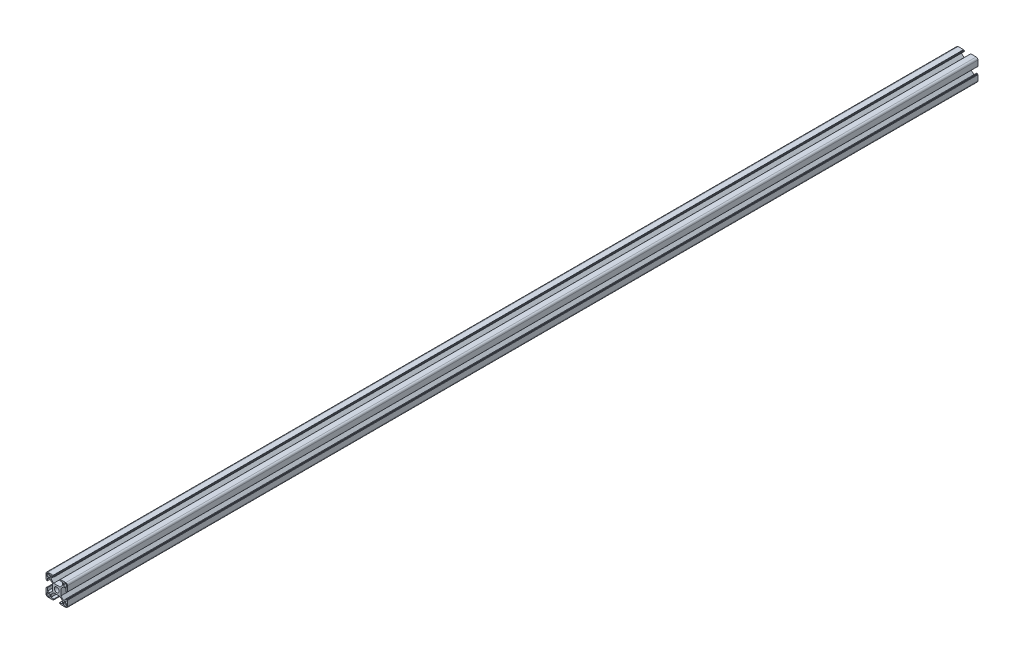
from build123d import *

# Parameters (mm, degrees)
SKETCH1_R      = 3.4
EXTRUDE1_DEPTH = 1268
EXTRUDE2_DEPTH = 1269.177432381


with BuildPart() as part:
    # Sketch1 → Extrude1 (new body)
    with BuildSketch(Plane.XY):
        with BuildLine():
            Line((-5.1, 14.2), (-5.1, 15))
            Line((-5.1, 15), (-12.5, 15))
            ThreePointArc((-12.5, 15), (-14.267766953, 14.267766953), (-15, 12.5))
            Line((-15, 12.5), (-15, 5.1))
            Line((-15, 5.1), (-14.2, 5.1))
            Line((-14.2, 5.1), (-14.2, 4.1))
            Line((-14.2, 4.1), (-13.2, 4.1))
            Line((-13.2, 4.1), (-13.2, 8.25))
            Line((-13.2, 8.25), (-9.522792206, 8.25))
            Line((-9.522792206, 8.25), (-5.7, 4.427207794))
            Line((-5.7, 4.427207794), (-5.7, -4.427207794))
            Line((-5.7, -4.427207794), (-9.522792206, -8.25))
            Line((-9.522792206, -8.25), (-13.2, -8.25))
            Line((-13.2, -8.25), (-13.2, -4.1))
            Line((-13.2, -4.1), (-14.2, -4.1))
            Line((-14.2, -4.1), (-14.2, -5.1))
            Line((-14.2, -5.1), (-15, -5.1))
            Line((-15, -5.1), (-15, -12.5))
            ThreePointArc((-15, -12.5), (-14.267766953, -14.267766953), (-12.5, -15))
            Line((-12.5, -15), (-5.1, -15))
            Line((-5.1, -15), (-5.1, -14.2))
            Line((-5.1, -14.2), (-4.1, -14.2))
            Line((-4.1, -14.2), (-4.1, -13.2))
            Line((-4.1, -13.2), (-8.25, -13.2))
            Line((-8.25, -13.2), (-8.25, -9.522792206))
            Line((-8.25, -9.522792206), (-4.427207794, -5.7))
            Line((-4.427207794, -5.7), (4.427207794, -5.7))
            Line((4.427207794, -5.7), (8.25, -9.522792206))
            Line((8.25, -9.522792206), (8.25, -13.2))
            Line((8.25, -13.2), (4.1, -13.2))
            Line((4.1, -13.2), (4.1, -14.2))
            Line((4.1, -14.2), (5.1, -14.2))
            Line((5.1, -14.2), (5.1, -15))
            Line((5.1, -15), (12.5, -15))
            ThreePointArc((12.5, -15), (14.267766953, -14.267766953), (15, -12.5))
            Line((15, -12.5), (15, -5.1))
            Line((15, -5.1), (14.2, -5.1))
            Line((14.2, -5.1), (14.2, -4.1))
            Line((14.2, -4.1), (13.2, -4.1))
            Line((13.2, -4.1), (13.2, -8.25))
            Line((13.2, -8.25), (9.522792206, -8.25))
            Line((9.522792206, -8.25), (5.7, -4.427207794))
            Line((5.7, -4.427207794), (5.7, 4.427207794))
            Line((5.7, 4.427207794), (9.522792206, 8.25))
            Line((9.522792206, 8.25), (13.2, 8.25))
            Line((13.2, 8.25), (13.2, 4.1))
            Line((13.2, 4.1), (14.2, 4.1))
            Line((14.2, 4.1), (14.2, 5.1))
            Line((14.2, 5.1), (15, 5.1))
            Line((15, 5.1), (15, 12.5))
            ThreePointArc((15, 12.5), (14.267766953, 14.267766953), (12.5, 15))
            Line((12.5, 15), (5.1, 15))
            Line((5.1, 15), (5.1, 14.2))
            Line((5.1, 14.2), (4.1, 14.2))
            Line((4.1, 14.2), (4.1, 13.2))
            Line((4.1, 13.2), (8.25, 13.2))
            Line((8.25, 13.2), (8.25, 9.522792206))
            Line((8.25, 9.522792206), (4.427207794, 5.7))
            Line((4.427207794, 5.7), (-4.427207794, 5.7))
            Line((-4.427207794, 5.7), (-8.25, 9.522792206))
            Line((-8.25, 9.522792206), (-8.25, 13.2))
            Line((-8.25, 13.2), (-4.1, 13.2))
            Line((-4.1, 13.2), (-4.1, 14.2))
            Line((-4.1, 14.2), (-5.1, 14.2))
        make_face()
        Circle(SKETCH1_R, mode=Mode.SUBTRACT)
    extrude(amount=EXTRUDE1_DEPTH)

    # Sketch2 → Extrude2 (cut, through all)
    with BuildSketch(Plane.XY.offset(1268)):
        with BuildLine():
            Line((13.7, 12.7), (13.7, 10.55))
            ThreePointArc((13.7, 10.55), (13.407106781, 9.842893219), (12.7, 9.55))
            Line((12.7, 9.55), (10.55, 9.55))
            ThreePointArc((10.55, 9.55), (9.842893219, 9.842893219), (9.55, 10.55))
            Line((9.55, 10.55), (9.55, 12.7))
            ThreePointArc((9.55, 12.7), (9.842893219, 13.407106781), (10.55, 13.7))
            Line((10.55, 13.7), (12.7, 13.7))
            ThreePointArc((12.7, 13.7), (13.407106781, 13.407106781), (13.7, 12.7))
        make_face()
        with BuildLine():
            Line((-12.7, 13.7), (-10.55, 13.7))
            ThreePointArc((-10.55, 13.7), (-9.842893219, 13.407106781), (-9.55, 12.7))
            Line((-9.55, 12.7), (-9.55, 10.55))
            ThreePointArc((-9.55, 10.55), (-9.842893219, 9.842893219), (-10.55, 9.55))
            Line((-10.55, 9.55), (-12.7, 9.55))
            ThreePointArc((-12.7, 9.55), (-13.407106781, 9.842893219), (-13.7, 10.55))
            Line((-13.7, 10.55), (-13.7, 12.7))
            ThreePointArc((-13.7, 12.7), (-13.407106781, 13.407106781), (-12.7, 13.7))
        make_face()
        with BuildLine():
            Line((12.7, -13.7), (10.55, -13.7))
            ThreePointArc((10.55, -13.7), (9.842893219, -13.407106781), (9.55, -12.7))
            Line((9.55, -12.7), (9.55, -10.55))
            ThreePointArc((9.55, -10.55), (9.842893219, -9.842893219), (10.55, -9.55))
            Line((10.55, -9.55), (12.7, -9.55))
            ThreePointArc((12.7, -9.55), (13.407106781, -9.842893219), (13.7, -10.55))
            Line((13.7, -10.55), (13.7, -12.7))
            ThreePointArc((13.7, -12.7), (13.407106781, -13.407106781), (12.7, -13.7))
        make_face()
        with BuildLine():
            Line((-13.7, -12.7), (-13.7, -10.55))
            ThreePointArc((-13.7, -10.55), (-13.407106781, -9.842893219), (-12.7, -9.55))
            Line((-12.7, -9.55), (-10.55, -9.55))
            ThreePointArc((-10.55, -9.55), (-9.842893219, -9.842893219), (-9.55, -10.55))
            Line((-9.55, -10.55), (-9.55, -12.7))
            ThreePointArc((-9.55, -12.7), (-9.842893219, -13.407106781), (-10.55, -13.7))
            Line((-10.55, -13.7), (-12.7, -13.7))
            ThreePointArc((-12.7, -13.7), (-13.407106781, -13.407106781), (-13.7, -12.7))
        make_face()
    extrude(amount=-EXTRUDE2_DEPTH, mode=Mode.SUBTRACT)


solid = part.part
